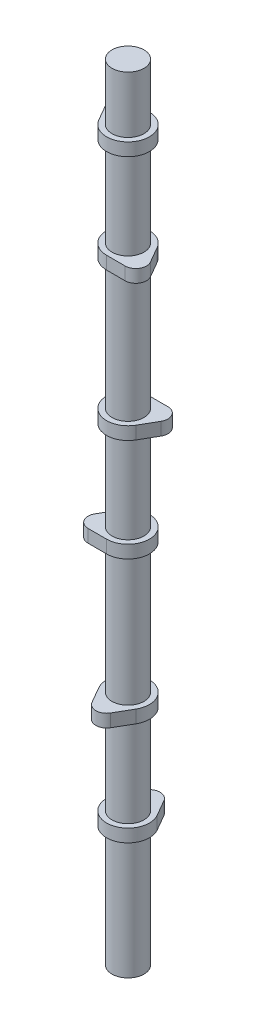
from build123d import *

# Parameters (mm, degrees)
BOSS_EXTRUDE1_DEPTH   = 3.81
BODY_MOVE_COPY2_ANGLE = 180
BOSS_EXTRUDE2_START   = 25.4
SKETCH2_R             = 9.5
BOSS_EXTRUDE2_DEPTH   = 73.025
LPATTERN1_COUNT       = 3
LPATTERN1_PITCH       = 146.05
BODY_MOVE_COPY3_ANGLE = 120
BODY_MOVE_COPY4_ANGLE = 120
SKETCH3_R             = 9.5
BOSS_EXTRUDE3_DEPTH   = 27.94


with BuildPart() as part:
    # Sketch1 → Boss-Extrude1 (new, symmetric)
    with BuildSketch(Plane(origin=(0, 0, 0), x_dir=(1, 0, 0), z_dir=(0, 1, 0))):
        with BuildLine():
            Line((-5.499261314, 15.875), (-10.998522628, 6.35))
            ThreePointArc((-10.998522628, 6.35), (0, -12.7), (10.998522628, 6.35))
            Line((10.998522628, 6.35), (5.499261314, 15.875))
            ThreePointArc((5.499261314, 15.875), (0, 19.05), (-5.499261314, 15.875))
        make_face()
    extrude(amount=BOSS_EXTRUDE1_DEPTH, both=True)


with BuildPart() as body_2:
    # Body-Move/Copy1: copy of part
    add(part.part.moved(Location((0, 60.96, 0))))


with BuildPart() as body_2_1:
    # Body-Move/Copy2: moved
    add(body_2.part.rotate(Axis((0, 0, 0), (0, 1, 0)), BODY_MOVE_COPY2_ANGLE))


with BuildPart() as part_1:
    add(part.part)

    add(body_2_1.part)  # Boss-Extrude2 merges body 2
    # Sketch2 → Boss-Extrude2 (add, symmetric)
    with BuildSketch(Plane(origin=(0, 0, 0), x_dir=(1, 0, 0), z_dir=(0, 1, 0)).offset(BOSS_EXTRUDE2_START)):
        Circle(SKETCH2_R)
    extrude(amount=BOSS_EXTRUDE2_DEPTH, both=True)


with BuildPart() as lpattern1_1:
    # LPattern1: pattern copy
    add(part_1.part.moved(Location(Vector(0, 1, 0) * (1 * LPATTERN1_PITCH))))


with BuildPart() as lpattern1_2:
    # LPattern1: pattern copy
    add(part_1.part.moved(Location(Vector(0, 1, 0) * (2 * LPATTERN1_PITCH))))


with BuildPart() as lpattern1_1_1:
    # Body-Move/Copy3: moved
    add(lpattern1_1.part.rotate(Axis((0, 0, 0), (0, 1, 0)), BODY_MOVE_COPY3_ANGLE))


with BuildPart() as lpattern1_2_1:
    # Body-Move/Copy4: moved
    add(lpattern1_2.part.rotate(Axis((0, 0, 0), (0, -1, 0)), BODY_MOVE_COPY4_ANGLE))


with BuildPart() as part_2:
    add(part_1.part)

    # Sketch3 → Boss-Extrude3 (add)
    with BuildSketch(Plane.XZ.offset(47.625)):
        Circle(SKETCH3_R)
    extrude(amount=BOSS_EXTRUDE3_DEPTH)

    # Combine1: union LPattern1_1, LPattern1_2
    add(lpattern1_1_1.part)
    add(lpattern1_2_1.part)


solid = part_2.part
